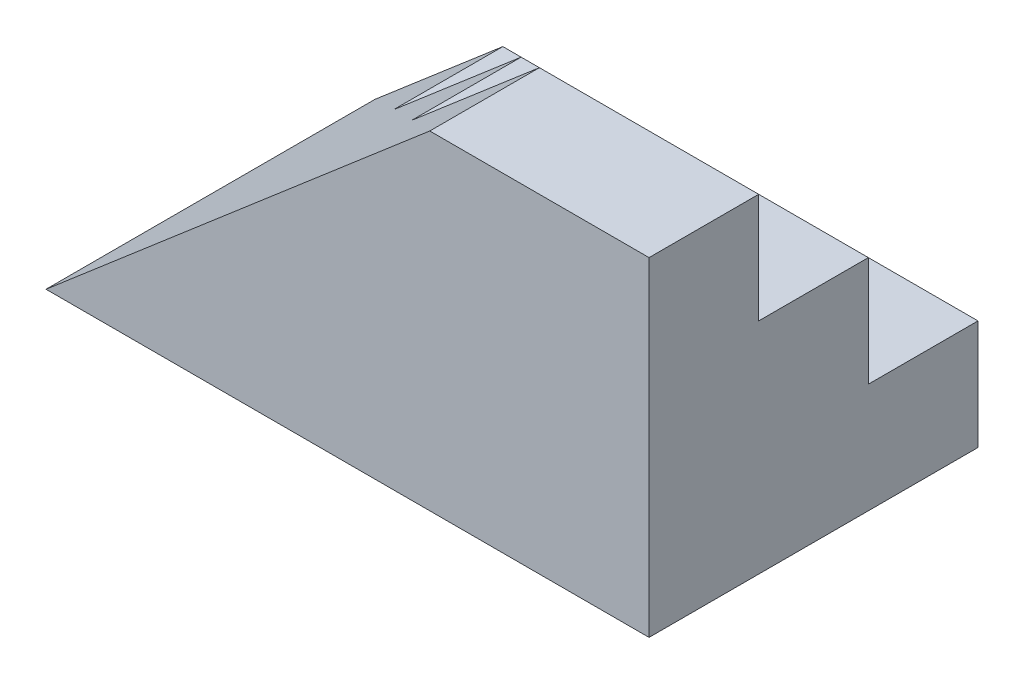
from build123d import *

# Parameters (mm, degrees)
SALIENTE_EXTRUIR1_DEPTH    = 110
CORTAR_EXTRUIR1_DEPTH      = 139.924439894
CORTAR_EXTRUIR1_DEPTH_BACK = 139.924439894


with BuildPart() as part:
    # Croquis2 → Saliente-Extruir1 (new body)
    with BuildSketch(Plane(origin=(0, 0, 0), x_dir=(0, 0, -1), z_dir=(1, 0, 0))):
        Polygon((0, 0), (60, 0), (60, 20), (40, 20), (40, 40), (20, 40), (20, 60), (0, 60), align=None)
    extrude(amount=SALIENTE_EXTRUIR1_DEPTH)

    # Croquis3 → Cortar-Extruir1 (cut, two sides: drawn at the far end of the back side and taken through both)
    with BuildSketch(Plane.XY.offset(-CORTAR_EXTRUIR1_DEPTH_BACK)):
        Polygon((-197.86172522, -169.595764474), (0, 0), (70, 60), (267.86172522, 229.595764474), (-71.329803728, 625.319214913), (-537.053254168, 226.127685965), align=None)
    extrude(amount=CORTAR_EXTRUIR1_DEPTH + CORTAR_EXTRUIR1_DEPTH_BACK, mode=Mode.SUBTRACT)


solid = part.part
